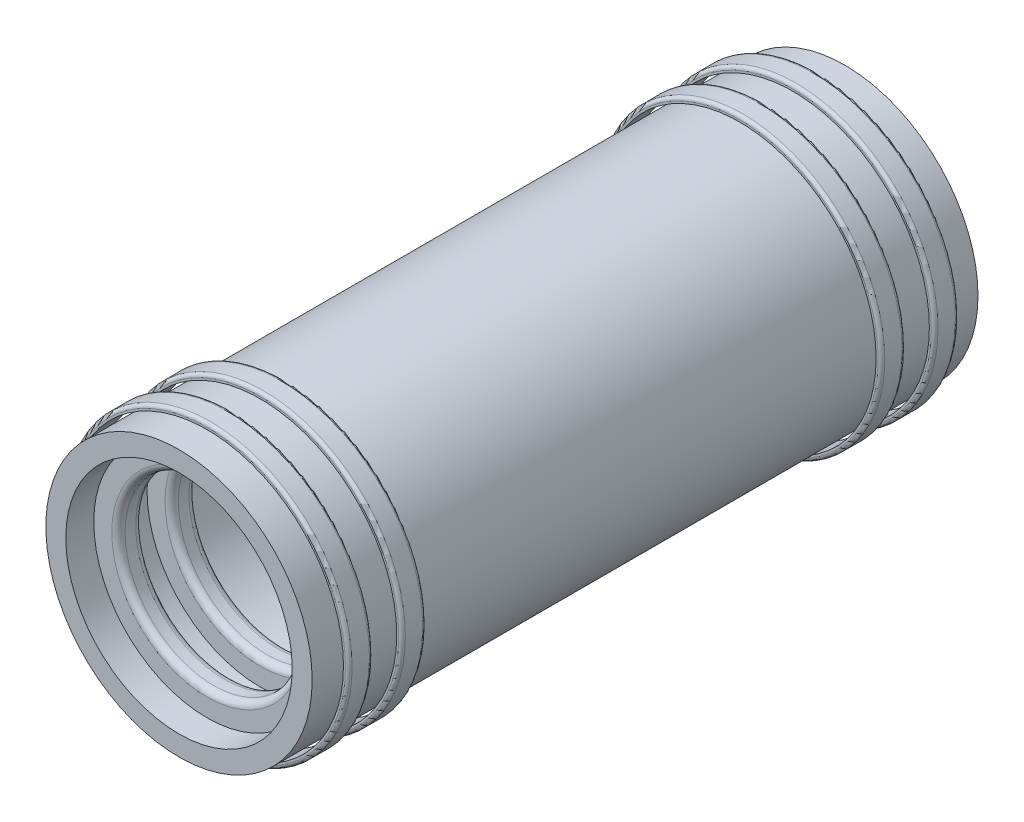
from build123d import *

# Parameters (mm, degrees)
SKETCH1_R            = 20
SKETCH1_R_2          = 17
BOSS_EXTRUDE1_DEPTH  = 100
SKETCH7_W            = 8
SKETCH7_H            = 3.6
FILLET2_R            = 1
FILLET2_OF_MIRROR5_R = 1
FILLET3_R            = 0.5
SKETCH9_R            = 20.5
SKETCH9_R_2          = 20
CUT_EXTRUDE4_DEPTH   = 105.438402939


with BuildPart() as part:
    # Sketch1 → Boss-Extrude1 (new body)
    with BuildSketch(Plane.XY):
        Circle(SKETCH1_R)
        Circle(SKETCH1_R_2, mode=Mode.SUBTRACT)
    extrude(amount=BOSS_EXTRUDE1_DEPTH)

    # Sketch7 → Revolve1 (revolve)
    with BuildSketch(Plane(origin=(0, 0, 0), x_dir=(1, 0, 0), z_dir=(0, 1, 0)), mode=Mode.PRIVATE) as revolve1_sk:
        with Locations((-17.3, -86)):
            Rectangle(SKETCH7_W, SKETCH7_H)
        with Locations((-17.3, -94)):
            Rectangle(SKETCH7_W, SKETCH7_H)
    revolve1 = revolve(revolve1_sk.sketch.rotate(Axis((0, 0, 100), (0, 0, -1)), 180), axis=Axis((0, 0, 100), (0, 0, -1)))

    # Fillet2
    fillet2_edges = [part.edges().sort_by_distance(p)[0] for p in [
        (-13.3, 0, 84.2),
        (-13.3, 0, 87.8),
        (-13.3, 0, 92.2),
        (-13.3, 0, 95.8),
    ]]
    fillet(fillet2_edges, radius=FILLET2_R)

    # Mirror5: Revolve1 across plane
    add(revolve1.mirror(Plane(origin=(0, 0, 50), x_dir=(1, 0, 0), z_dir=(0, 0, -1))))

    # Fillet2 of Mirror5
    fillet2_of_mirror5_edges = [part.edges().sort_by_distance(p)[0] for p in [
        (-13.3, 0, 15.8),
        (-13.3, 0, 12.2),
        (-13.3, 0, 7.8),
        (-13.3, 0, 4.2),
    ]]
    fillet(fillet2_of_mirror5_edges, radius=FILLET2_OF_MIRROR5_R)

    # Fillet3
    fillet3_edges = [part.edges().sort_by_distance(p)[0] for p in [
        (-21.3, 0, 87.8),
        (-21.3, 0, 84.2),
        (-21.3, 0, 92.2),
        (-21.3, 0, 95.8),
        (-21.3, 0, 15.8),
        (-21.3, 0, 12.2),
        (-21.3, 0, 4.2),
        (-21.3, 0, 7.8),
    ]]
    fillet(fillet3_edges, radius=FILLET3_R)

    # Sketch9 → Cut-Extrude4 (cut, through all)
    with BuildSketch(Plane(origin=(0, 0, 0), x_dir=(-1, 0, 0), z_dir=(0, 0, -1))):
        Circle(SKETCH9_R)
        with Locations(Location((0, 0, 0), (0, 0, 180))):
            Circle(SKETCH9_R_2, mode=Mode.SUBTRACT)
    extrude(amount=-CUT_EXTRUDE4_DEPTH, mode=Mode.SUBTRACT)


with BuildPart() as cut_extrude4_piece_1:
    # of the separate pieces the step leaves, piece 1, a body of its own (cut_extrude4_pieces)
    add(part.part.solids().sort_by_distance((20, 0, 0))[0])


with BuildPart() as cut_extrude4_piece_2:
    # of the separate pieces the step leaves, piece 2, a body of its own (cut_extrude4_pieces)
    add(part.part.solids().sort_by_distance((20.8, 0, 4.2))[0])


with BuildPart() as cut_extrude4_piece_3:
    # of the separate pieces the step leaves, piece 3, a body of its own (cut_extrude4_pieces)
    add(part.part.solids().sort_by_distance((20.8, 0, 92.2))[0])


with BuildPart() as cut_extrude4_piece_4:
    # of the separate pieces the step leaves, piece 4, a body of its own (cut_extrude4_pieces)
    add(part.part.solids().sort_by_distance((20.8, 0, 84.2))[0])


with BuildPart() as cut_extrude4_piece_5:
    # of the separate pieces the step leaves, piece 5, a body of its own (cut_extrude4_pieces)
    add(part.part.solids().sort_by_distance((20.8, 0, 12.2))[0])


solid = Compound([cut_extrude4_piece_1.part, cut_extrude4_piece_2.part, cut_extrude4_piece_3.part, cut_extrude4_piece_4.part, cut_extrude4_piece_5.part])
